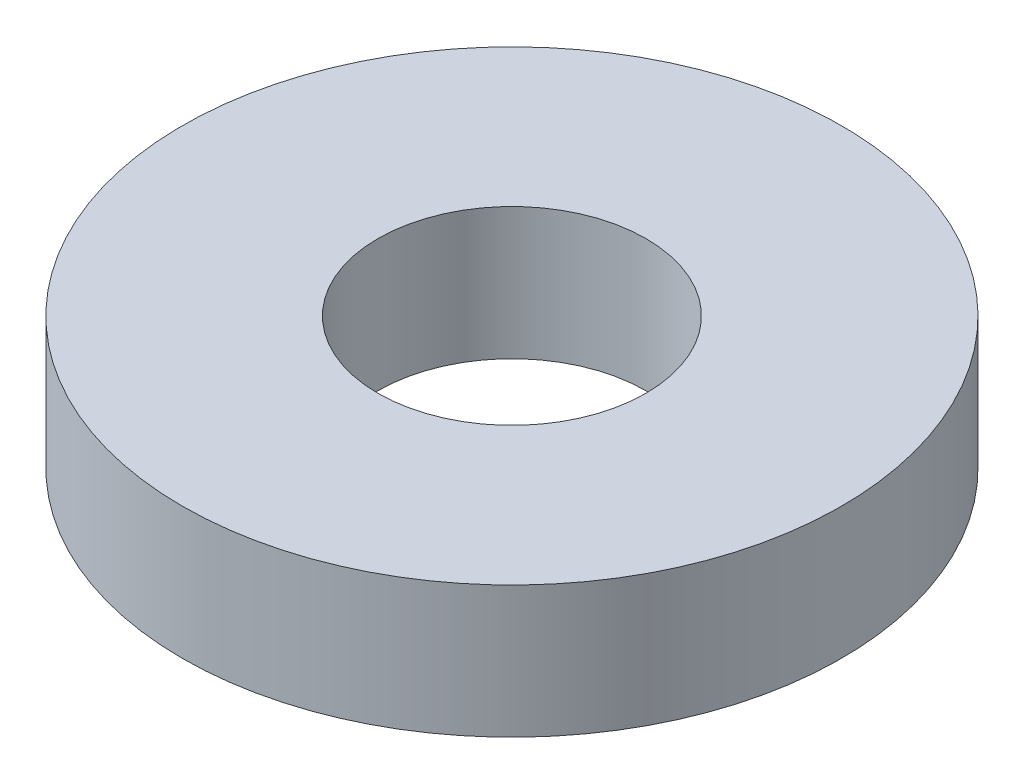
from build123d import *

# Parameters (mm, degrees)
SKETCH1_R           = 7.5
SKETCH1_R_2         = 3.05
BOSS_EXTRUDE1_DEPTH = 3
CIRPATTERN1_COUNT   = 10


with BuildPart() as part:
    # Sketch1 → Boss-Extrude1 (new body)
    with BuildSketch(Plane(origin=(0, 0, 0), x_dir=(1, 0, 0), z_dir=(0, 1, 0))):
        Circle(SKETCH1_R)
        Circle(SKETCH1_R_2, mode=Mode.SUBTRACT)
    extrude(amount=BOSS_EXTRUDE1_DEPTH)

    # Sketch3 → Revolve2 (revolve)
    with BuildSketch(Plane(origin=(0, 0, 0), x_dir=(0, 0, -1), z_dir=(1, 0, 0))):
        with BuildLine():
            Line((4.35, 0), (5.75, 0))
            ThreePointArc((5.75, 0), (5.05, -0.7), (4.35, 0))
        make_face()
    revolve2 = revolve(axis=Axis((0, 0, -8.25), (0, 0, 1)))

    # CirPattern1: Revolve2 ×10 about axis
    cirpattern1_axis = Axis((0, -0.885, 0), (0, 1, 0))
    for i in range(1, CIRPATTERN1_COUNT):
        add(revolve2.rotate(cirpattern1_axis, i * 360 / CIRPATTERN1_COUNT))


solid = part.part
